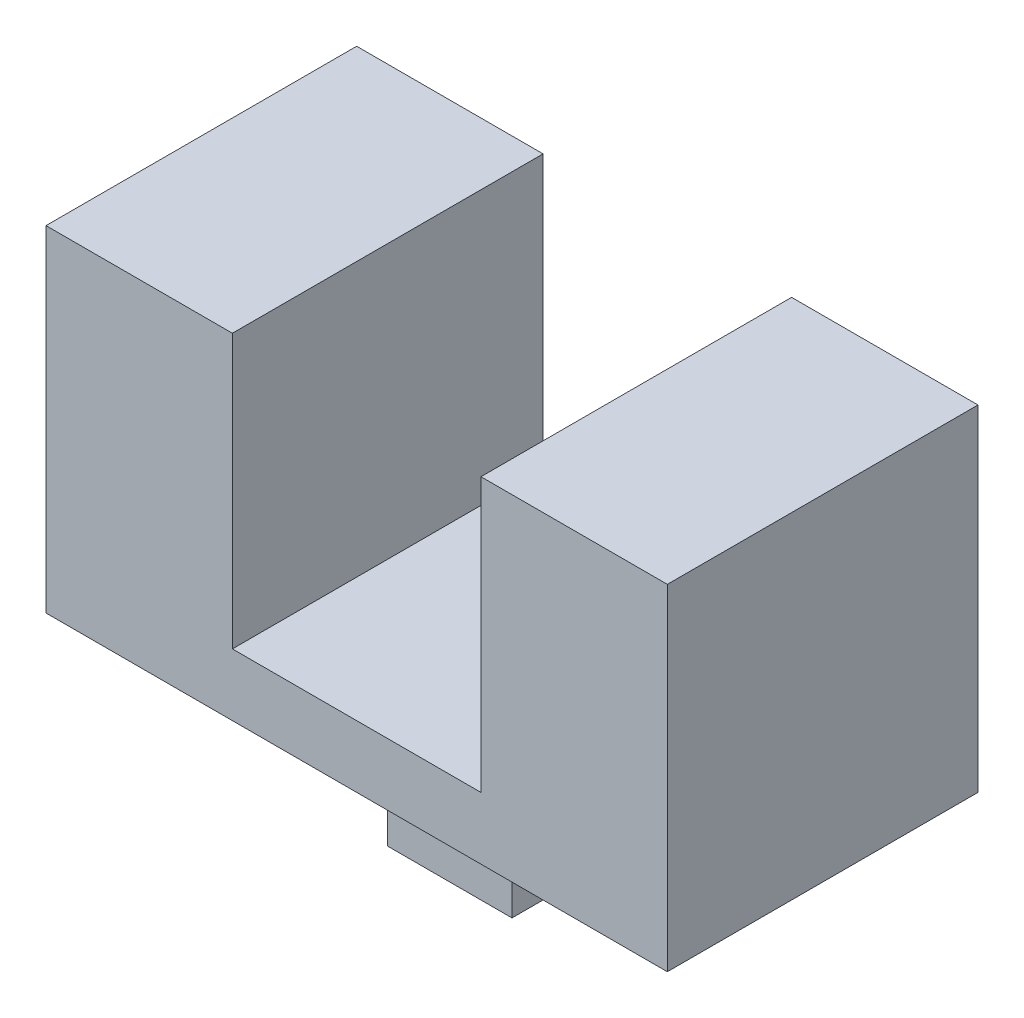
from build123d import *

# Parameters (mm, degrees)
BOSS_EXTRUDE1_DEPTH = 6.35
SKETCH2_W           = 2.54
SKETCH2_H           = 2.54
BOSS_EXTRUDE2_DEPTH = 2.54


with BuildPart() as part:
    # Sketch1 → Boss-Extrude1 (new body)
    with BuildSketch(Plane.XY):
        Polygon((6.35, -3.429), (-6.35, -3.429), (-6.35, 3.429), (-2.54, 3.429), (-2.54, -2.159), (2.54, -2.159), (2.54, 3.429), (6.35, 3.429), align=None)
    extrude(amount=BOSS_EXTRUDE1_DEPTH)

    # Sketch2 → Boss-Extrude2 (add)
    with BuildSketch(Plane.XZ.offset(3.429)):
        with Locations((0, 3.175)):
            Rectangle(SKETCH2_W, SKETCH2_H)
    extrude(amount=BOSS_EXTRUDE2_DEPTH)


solid = part.part
